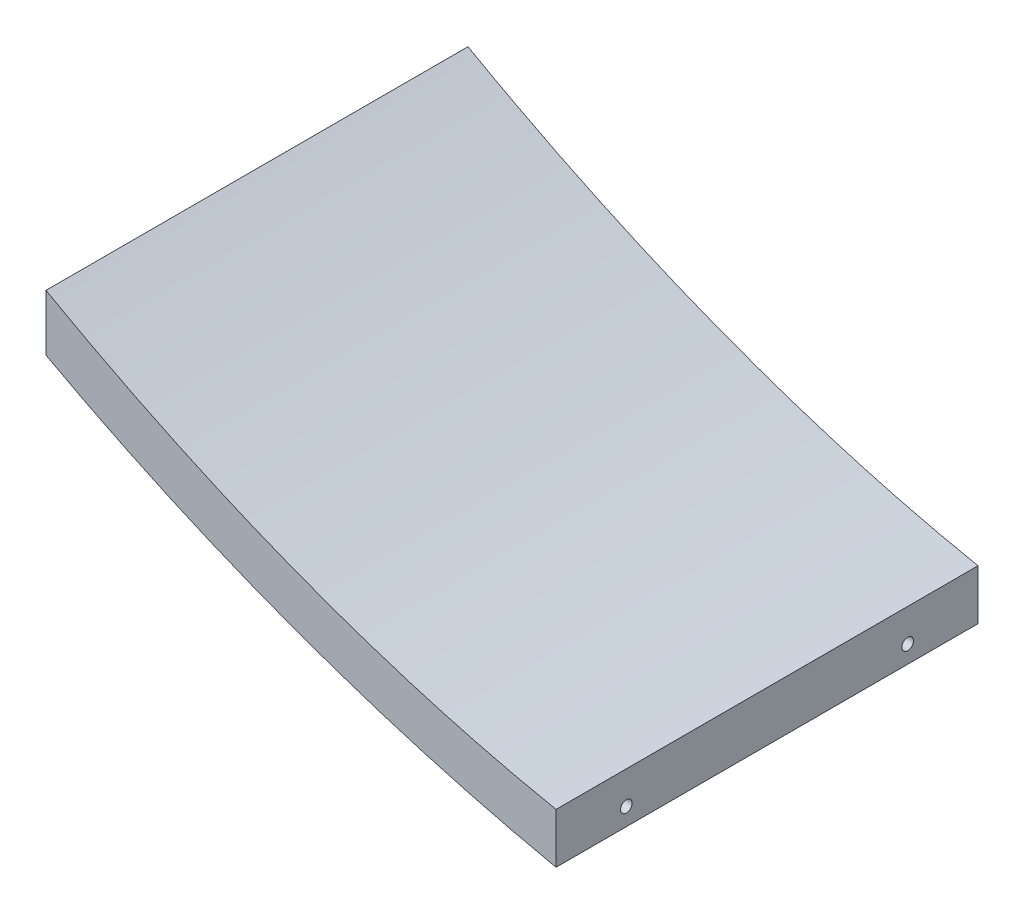
from build123d import *

# Parameters (mm, degrees)
BOSS_EXTRUDE1_DEPTH = 120
SKETCH2_R           = 1.65
CUT_EXTRUDE1_DEPTH  = 280.59760166
SKETCH3_R           = 3
CUT_EXTRUDE2_DEPTH  = 275.54310452


with BuildPart() as part:
    # Sketch1 → Boss-Extrude1 (new body)
    with BuildSketch(Plane.XY):
        with BuildLine():
            Line((-80.2, -206.72863576), (-80.2, -192.469888951))
            add(Edge.make_bspline(
                [(-80.2, -192.469888951), (-81.626071271, -192.184311675), (-92.438149368, -189.961391225), (-112.635650998, -184.99089612), (-140.791197461, -176.082259845), (-164.252323786, -167.009400213), (-183.020628451, -158.761564514), (-197.095113634, -152.081763048), (-208.827276173, -146.10094494), (-218.204067638, -141.07390287), (-222.908176033, -138.469074724), (-225.24513062, -137.154537769)],
                knots=[0.501416014, 0.501416014, 0.501416014, 0.501416014, 0.501491553, 0.501988738, 0.502485922, 0.502983107, 0.503231699, 0.503480291, 0.503728883, 0.50385318, 0.503977476, 0.503977476, 0.503977476, 0.503977476], degree=3))
            Line((-225.24513062, -137.154537769), (-225.24513062, -153.140671849))
            ThreePointArc((-225.24513062, -153.140671849), (-154.65433281, -185.163318021), (-80.2, -206.72863576))
        make_face()
    extrude(amount=-BOSS_EXTRUDE1_DEPTH)

    # Sketch2 → Cut-Extrude1 (cut, through all)
    with BuildSketch(Plane(origin=(-80.2, 0, 0), x_dir=(0, 0, -1), z_dir=(1, 0, 0))):
        with Locations(Location((100, -201.72863576, 0), (0, 0, 90))):
            Circle(SKETCH2_R)
        with Locations(Location((20, -201.72863576, 0), (0, 0, 90))):
            Circle(SKETCH2_R)
    extrude(amount=-CUT_EXTRUDE1_DEPTH, mode=Mode.SUBTRACT)

    # Sketch3 → Cut-Extrude2 (cut, through all)
    with BuildSketch(Plane(origin=(-90.2, 0, 0), x_dir=(0, 0, -1), z_dir=(1, 0, 0))):
        with Locations((100, -201.72863576)):
            Circle(SKETCH3_R)
        with Locations((20, -201.72863576)):
            Circle(SKETCH3_R)
    extrude(amount=-CUT_EXTRUDE2_DEPTH, mode=Mode.SUBTRACT)


solid = part.part
